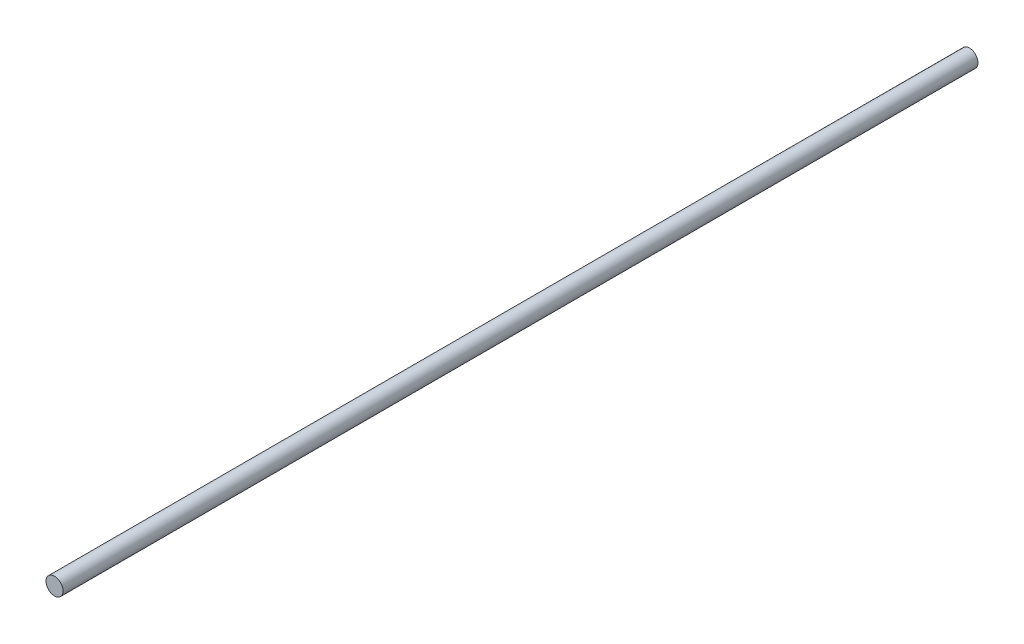
from build123d import *

# Parameters (mm, degrees)
SKETCH_1_R           = 2
CABLE_ENVELOPE_DEPTH = 214


with BuildPart() as part:
    # 草图1 → Cable_envelope (new body)
    with BuildSketch(Plane.XY):
        Circle(SKETCH_1_R)
    extrude(amount=CABLE_ENVELOPE_DEPTH)


solid = part.part
